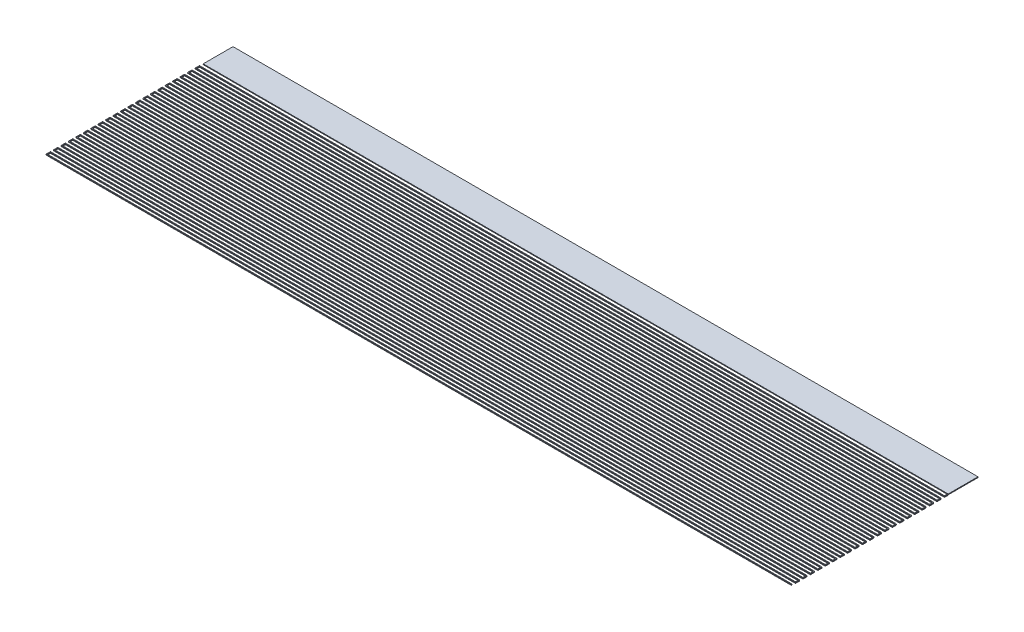
from build123d import *

# Parameters (mm, degrees)
SKETCH1_W           = 200
SKETCH1_H           = 8
BOSS_EXTRUDE1_DEPTH = 0.2
EXTRUDE_THIN1_DEPTH = 0.2
LPATTERN1_COUNT     = 21
LPATTERN1_PITCH     = 2


with BuildPart() as part:
    # Sketch1 → Boss-Extrude1 (new body)
    with BuildSketch(Plane(origin=(0, 0, 0), x_dir=(1, 0, 0), z_dir=(0, 1, 0))):
        with Locations((100, 4)):
            Rectangle(SKETCH1_W, SKETCH1_H)
    extrude(amount=BOSS_EXTRUDE1_DEPTH)

    # Sketch2 → Extrude-Thin1 (add)
    with BuildSketch(Plane(origin=(0, 0, 0), x_dir=(1, 0, 0), z_dir=(0, 1, 0))):
        Polygon((199.9, 0), (199.9, -0.9), (-0.1, -0.9), (-0.1, -2.1), (200, -2.1), (200, -1.9), (0.1, -1.9), (0.1, -1.1), (200.1, -1.1), (200.1, 0), align=None)
    extrude_thin1 = extrude(amount=EXTRUDE_THIN1_DEPTH)

    # LPattern1: Extrude-Thin1 ×21
    with Locations(*[(0, 0, i * LPATTERN1_PITCH) for i in range(1, LPATTERN1_COUNT)]):
        add(extrude_thin1)


solid = part.part
